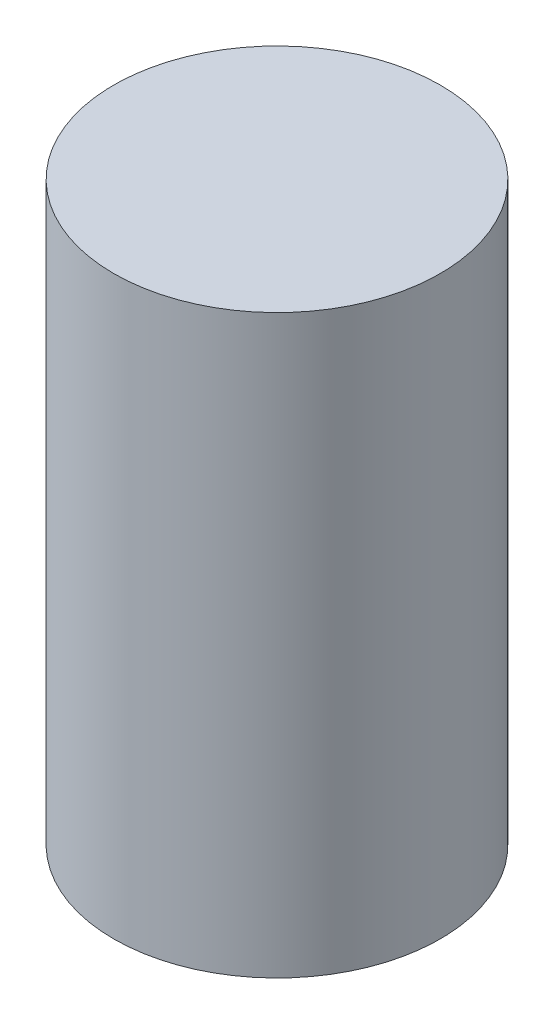
from build123d import *

# Parameters (mm, degrees)
SKETCH1_R           = 25.5
BOSS_EXTRUDE1_DEPTH = 90


with BuildPart() as part:
    # Sketch1 → Boss-Extrude1 (new body)
    with BuildSketch(Plane(origin=(0, 0, 0), x_dir=(1, 0, 0), z_dir=(0, 1, 0))):
        with Locations(Location((0, 0, 0), (0, 0, 90))):
            Circle(SKETCH1_R)
    extrude(amount=BOSS_EXTRUDE1_DEPTH)


solid = part.part
